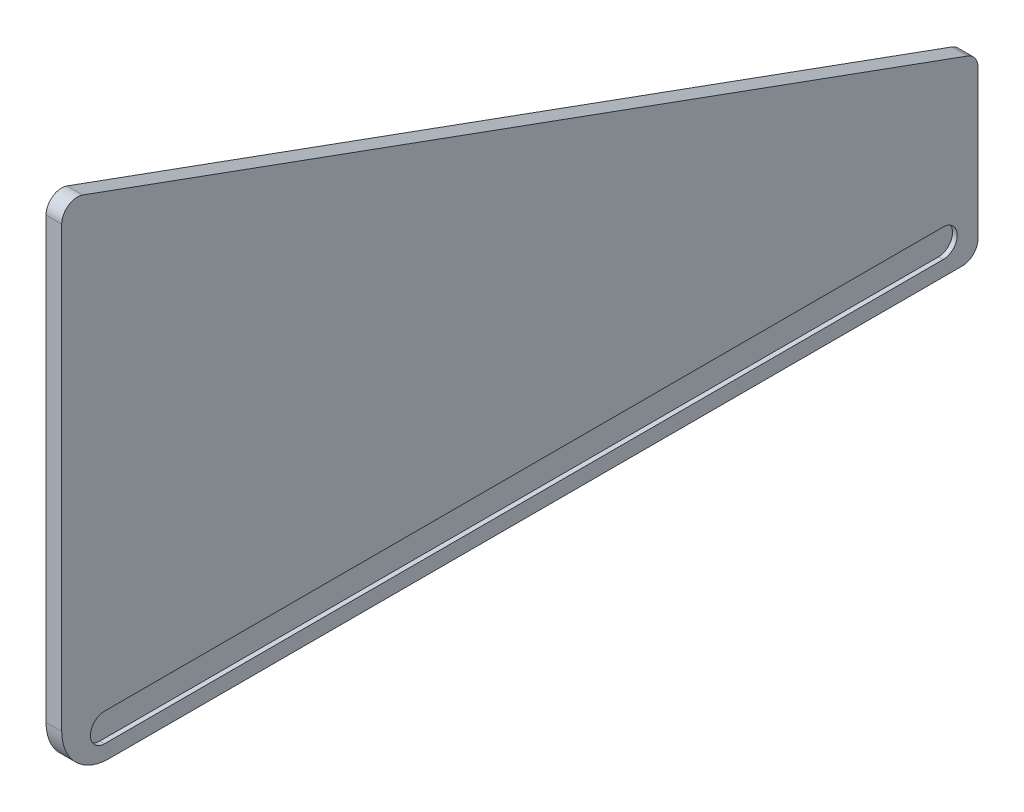
from build123d import *

# Parameters (mm, degrees)
BOSS_EXTRUDE1_DEPTH = 10
CUT_EXTRUDE4_DEPTH  = 3
CUT_EXTRUDE5_DEPTH  = 3


with BuildPart() as part:
    # Sketch1 → Boss-Extrude1 (new body)
    with BuildSketch(Plane(origin=(0, 0, 0), x_dir=(0, 0, -1), z_dir=(1, 0, 0))):
        with BuildLine():
            Line((0, -14.281480067), (0, -294.281480067))
            ThreePointArc((0, -294.281480067), (8.786796564, -315.494683503), (30, -324.281480067))
            Line((30, -324.281480067), (573.815572472, -324.281480067))
            ThreePointArc((573.815572472, -324.281480067), (580.886640283, -321.352547879), (583.815572472, -314.281480067))
            Line((583.815572472, -314.281480067), (583.815572472, -219.493566063))
            ThreePointArc((583.815572472, -219.493566063), (582.007092914, -213.757801699), (577.235773905, -210.096639855))
            Line((577.235773905, -210.096639855), (13.420201433, -4.88455386))
            ThreePointArc((13.420201433, -4.88455386), (4.264235636, -6.089959625), (0, -14.281480067))
        make_face()
    extrude(amount=BOSS_EXTRUDE1_DEPTH)

    # Sketch3 → Cut-Extrude4 (cut)
    with BuildSketch(Plane.ZY):
        with BuildLine():
            ThreePointArc((-23.162175785, -218.017297737), (-17.576945532, -207.678107035), (-26.738120061, -200.318314743))
            add(Edge.make_bspline(
                [(-26.738120061, -200.318314743), (-45.914354434, -200.660753587), (-151.32107334, -255.510398156), (-414.880335601, -286.385074175), (-542.431128002, -257.731725159), (-546.154906269, -257.731029979)],
                knots=[0, 0, 0, 0, 0.560935224, 0.660935224, 1, 1, 1, 1], degree=3))
            ThreePointArc((-546.154906269, -257.731029979), (-563.288388976, -273.27487263), (-549.474047026, -291.831036849))
            add(Edge.make_bspline(
                [(-549.474047026, -291.831036849), (-474.750080899, -306.502271197), (-284.669923623, -324.572171749), (-143.080818041, -266.034178467), (-23.162175785, -218.017297737)],
                knots=[0, 0, 0, 0, 0.423888314, 1, 1, 1, 1], degree=3))
        make_face()
        with BuildLine():
            ThreePointArc((-26.950185671, -47.737214996), (-28.17113687, -40.715672082), (-35.124917897, -39.154353359))
            add(Edge.make_bspline(
                [(-35.124917897, -39.154353359), (-50.602952828, -45.122445935), (-99.042539, -170.661871263), (-331.224003862, -171.181746235), (-353.169530365, -171.181734297)],
                knots=[0, 0, 0, 0, 0.639195597, 1, 1, 1, 1], degree=3))
            ThreePointArc((-353.169530365, -171.181734297), (-370.309371751, -186.812434708), (-356.32010769, -205.316311305))
            add(Edge.make_bspline(
                [(-356.32010769, -205.316311305), (-352.838937223, -205.964445921), (-121.396454164, -217.989087479), (-35.312726243, -66.629555086), (-26.950185671, -47.737214996)],
                knots=[0, 0, 0, 0, 0.40968467, 1, 1, 1, 1], degree=3))
        make_face()
    extrude(amount=-CUT_EXTRUDE4_DEPTH, mode=Mode.SUBTRACT)

    # Sketch5 → Cut-Extrude5 (cut)
    with BuildSketch(Plane(origin=(10, 0, 0), x_dir=(0, 0, -1), z_dir=(1, 0, 0))):
        with BuildLine():
            Line((561.587294138, -296.630106089), (27.291979273, -296.630106089))
            ThreePointArc((27.291979273, -296.630106089), (18.291979273, -305.630106089), (27.291979273, -314.630106089))
            Line((27.291979273, -314.630106089), (561.587294138, -314.630106089))
            ThreePointArc((561.587294138, -314.630106089), (570.587294138, -305.630106089), (561.587294138, -296.630106089))
        make_face()
    extrude(amount=-CUT_EXTRUDE5_DEPTH, mode=Mode.SUBTRACT)


solid = part.part
